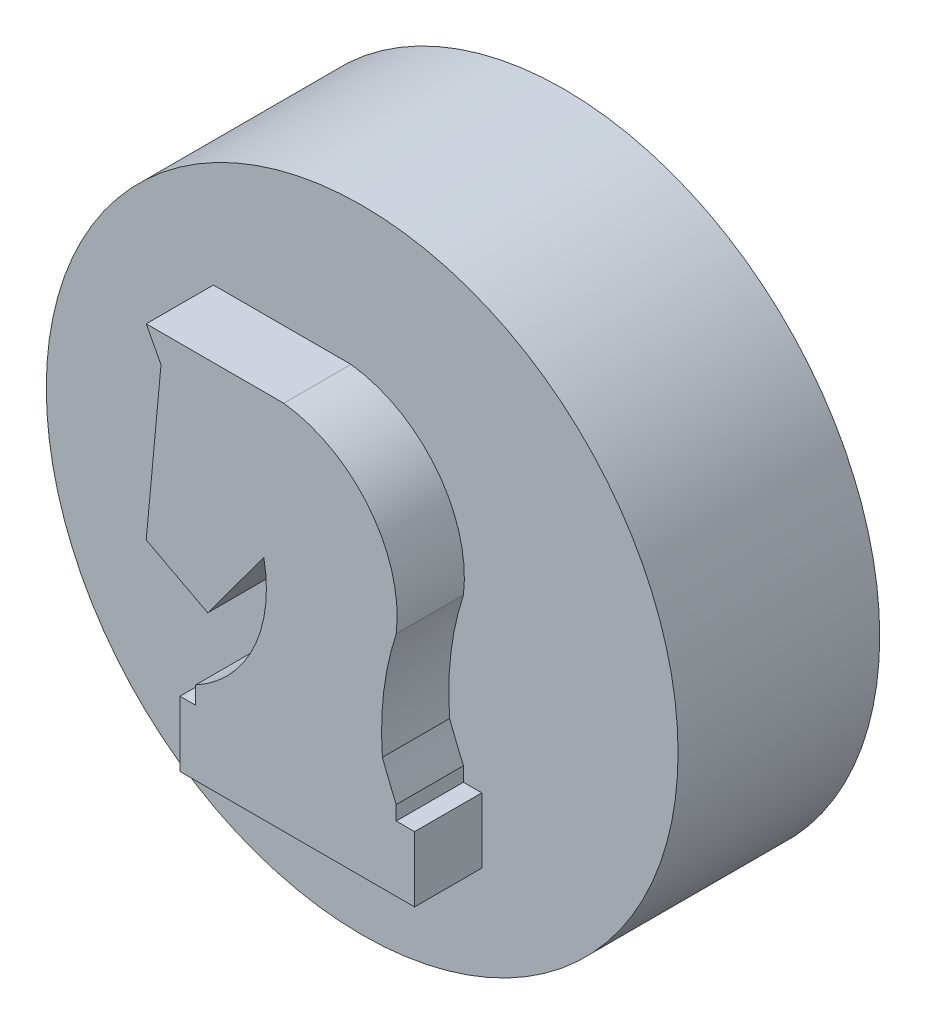
from build123d import *

# Parameters (mm, degrees)
SKETCH1_R           = 11.938
SKETCH1_R_2         = 8.763
BOSS_EXTRUDE1_DEPTH = 5.08
SKETCH2_R           = 11.938
BOSS_EXTRUDE2_DEPTH = 2.54
BOSS_EXTRUDE5_DEPTH = 2.54


with BuildPart() as part:
    # Sketch1 → Boss-Extrude1 (new body)
    with BuildSketch(Plane.XY):
        Circle(SKETCH1_R)
        Circle(SKETCH1_R_2, mode=Mode.SUBTRACT)
    extrude(amount=BOSS_EXTRUDE1_DEPTH)

    # Sketch2 → Boss-Extrude2 (add)
    with BuildSketch(Plane.XY.offset(5.08)):
        Circle(SKETCH2_R)
    extrude(amount=BOSS_EXTRUDE2_DEPTH)

    # Sketch3 → Boss-Extrude5 (add)
    with BuildSketch(Plane.XY.offset(7.62)):
        with BuildLine():
            Line((-3.749775554, -5.025912703), (-3.749775554, -4.357730643))
            ThreePointArc((-3.749775554, -4.357730643), (-1.563899962, -2.052721882), (-1.176728716, 1.100247499))
            Line((-1.176728716, 1.100247499), (-3.294944042, -1.771688619))
            Line((-3.294944042, -1.771688619), (-5.621082346, -0.55014113))
            Line((-5.621082346, -0.55014113), (-5.062289346, 5.462731457))
            Line((-5.062289346, 5.462731457), (-5.621082346, 6.523138639))
            Line((-5.621082346, 6.523138639), (-0.422811908, 6.523138639))
            ThreePointArc((-0.422811908, 6.523138639), (2.824920532, 4.69173738), (3.826417915, 1.100247499))
            ThreePointArc((3.826417915, 1.100247499), (3.353249923, -1.024672289), (3.304473127, -3.20108973))
            ThreePointArc((3.304473127, -3.20108973), (3.557112423, -3.847120346), (3.826417915, -4.486382985))
            Line((3.826417915, -4.486382985), (3.826417915, -5.025912703))
            Line((3.826417915, -5.025912703), (4.519556937, -5.025912703))
            Line((4.519556937, -5.025912703), (4.519556937, -7.490281135))
            Line((4.519556937, -7.490281135), (-4.344219843, -7.490281135))
            Line((-4.344219843, -7.490281135), (-4.344219843, -5.025912703))
            Line((-4.344219843, -5.025912703), (-3.749775554, -5.025912703))
        make_face()
    extrude(amount=BOSS_EXTRUDE5_DEPTH)


solid = part.part
